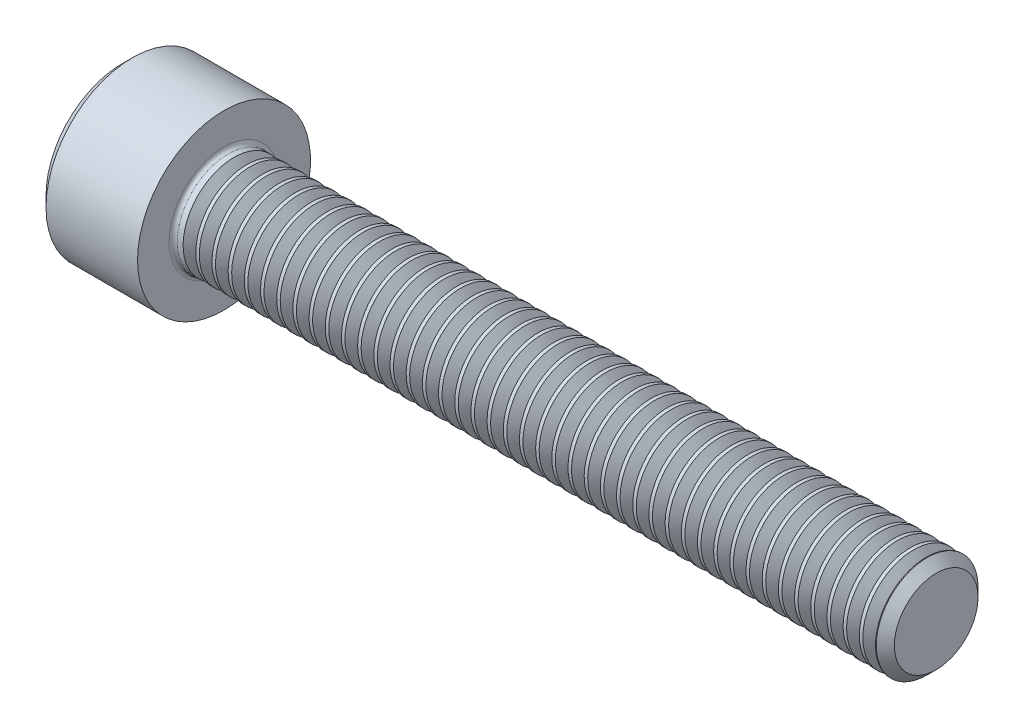
from build123d import *

# Parameters (mm, degrees)
FILLET1_R       = 0.2
HEX_2_DEPTH     = 2.5
THDSCHPAT_COUNT = 43
THDSCHPAT_PITCH = 0.795348837


with BuildPart() as part:
    # BodySke → Base-Revolve (revolve)
    with BuildSketch(Plane.XY, mode=Mode.PRIVATE) as base_revolve_sk:
        Polygon((0, 0), (0, 3.75), (0.5, 4.25), (5, 4.25), (5, 2.5), (39.555, 2.5), (40, 2.055), (40, 0), align=None)
    revolve(base_revolve_sk.sketch.rotate(Axis((-31.75, 0, 0), (1, 0, 0)), 90), axis=Axis((-31.75, 0, 0), (1, 0, 0)))

    # Fillet1
    fillet1_edges = [part.edges().sort_by_distance(p)[0] for p in [
        (5, 0, -2.5),
    ]]
    fillet(fillet1_edges, radius=FILLET1_R)

    # Sketch2 → Hex-PreBroach (revolve, cut)
    with BuildSketch(Plane.XY, mode=Mode.PRIVATE) as hex_prebroach_sk:
        Polygon((0, 2.042), (2.5, 2.042), (3.67894925, 0), (0, 0), align=None)
    revolve(hex_prebroach_sk.sketch.rotate(Axis((0, 0, 0), (1, 0, 0)), 90), axis=Axis((0, 0, 0), (1, 0, 0)), mode=Mode.SUBTRACT)

    # Sketch3 → Hex 2 (cut)
    with BuildSketch(Plane(origin=(0, 0, 0), x_dir=(0, 0.500000000000001, 0.866025403784438), z_dir=(-1, 0, 0))):
        Polygon((1.17894925, 2.042), (-1.17894925, 2.042), (-2.357898499, 0), (-1.17894925, -2.042), (1.17894925, -2.042), (2.357898499, 0), align=None)
    extrude(amount=-HEX_2_DEPTH, mode=Mode.SUBTRACT)

    # ThdSchSke → ThreadSchematic (revolve, cut)
    with BuildSketch(Plane.XY):
        Polygon((5.8, -2.055), (5.488407645, -2.5), (5.488407645, -3.125), (6.111592355, -3.125), (6.111592355, -2.5), align=None)
    threadschematic = revolve(axis=Axis((-3.175, 0, 0), (1, 0, 0)), mode=Mode.SUBTRACT)

    # ThdSchPat: ThreadSchematic ×43
    with Locations(*[(i * THDSCHPAT_PITCH, 0, 0) for i in range(1, THDSCHPAT_COUNT)]):
        add(threadschematic, mode=Mode.SUBTRACT)


solid = part.part
